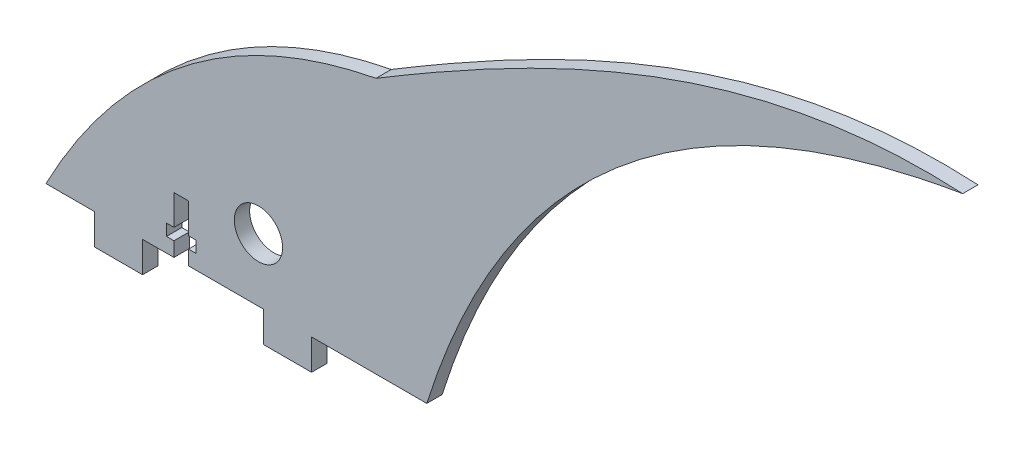
from build123d import *

# Parameters (mm, degrees)
BOSS_EXTRUDE1_DEPTH = 3.175
SKETCH3_W           = 10
SKETCH3_H           = 6.35
BOSS_EXTRUDE2_DEPTH = 3.175
SKETCH4_R           = 5
CUT_EXTRUDE1_DEPTH  = 114.626458313
CUT_EXTRUDE2_DEPTH  = 114.626458313


with BuildPart() as part:
    # Sketch2 → Boss-Extrude1 (new body)
    with BuildSketch(Plane.XY):
        with BuildLine():
            Line((-100.609869354, -40.604219784), (-21.744841678, -40.604219784))
            add(Edge.make_bspline(
                [(89.238978774, 52.511300132), (2.91962202, 37.989392405), (-21.744841678, -40.604219784)],
                knots=[0, 0, 0, 1, 1, 1], degree=2))
            add(Edge.make_bspline(
                [(89.238978774, 52.511300132), (45.213595461, 54.960877806), (4.522727388, 34.592562225), (-32.259998233, 12.458533919)],
                knots=[0, 0, 0, 0, 1, 1, 1, 1], degree=3))
            add(Edge.make_bspline(
                [(-32.259998233, 12.458533919), (-77.388125592, 3.705886884), (-100.609869354, -40.604219784)],
                knots=[0, 0, 0, 1, 1, 1], degree=2))
        make_face()
    extrude(amount=BOSS_EXTRUDE1_DEPTH)

    # Sketch3 → Boss-Extrude2 (add)
    with BuildSketch(Plane.XY.offset(3.175)):
        with Locations((-85.609869354, -43.779219784)):
            Rectangle(SKETCH3_W, SKETCH3_H)
        with Locations((-50.609869354, -43.779219784)):
            Rectangle(SKETCH3_W, SKETCH3_H)
    extrude(amount=-BOSS_EXTRUDE2_DEPTH)

    # Sketch4 → Cut-Extrude1 (cut, through all)
    with BuildSketch(Plane.XY.offset(3.175)):
        with Locations((-56.609869354, -27.604219784)):
            Circle(SKETCH4_R)
    extrude(amount=-CUT_EXTRUDE1_DEPTH, mode=Mode.SUBTRACT)

    # Sketch5 → Cut-Extrude2 (cut, through all)
    with BuildSketch(Plane.XY.offset(3.175)):
        Polygon((-74.109869354, -37.604219784), (-74.109869354, -40.604219784), (-71.109869354, -40.604219784), (-71.109869354, -37.604219784), (-69.559869354, -37.604219784), (-69.559869354, -35.204219784), (-71.109869354, -35.204219784), (-71.109869354, -28.954219784), (-74.109869354, -28.954219784), (-74.109869354, -35.204219784), (-75.659869354, -35.204219784), (-75.659869354, -37.604219784), align=None)
    extrude(amount=-CUT_EXTRUDE2_DEPTH, mode=Mode.SUBTRACT)


solid = part.part
